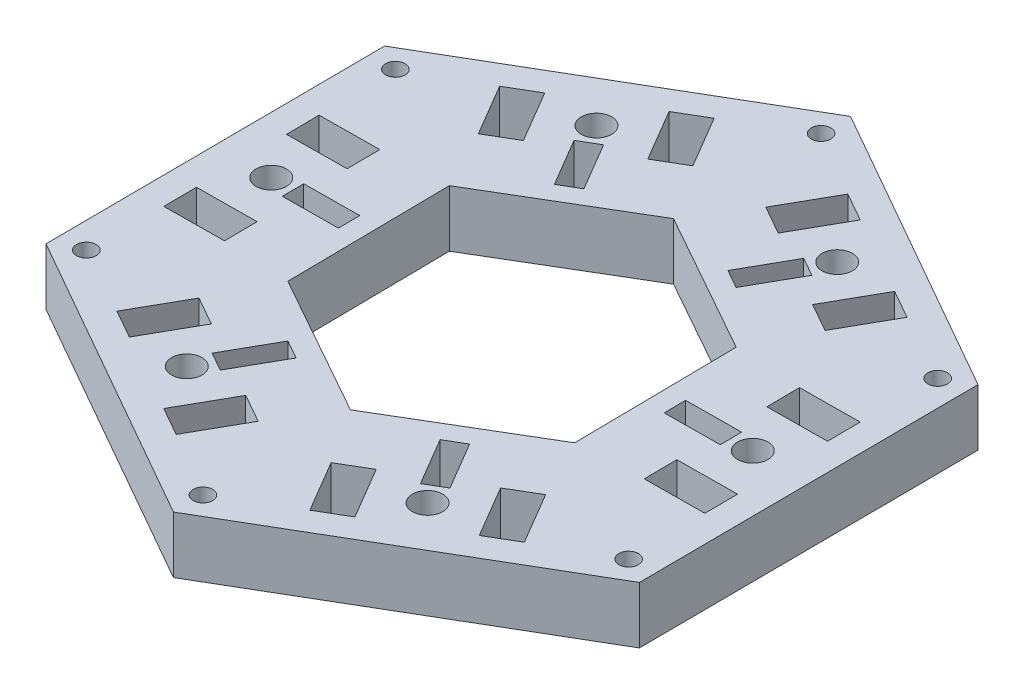
from build123d import *

# Parameters (mm, degrees)
SKETCH1_R           = 1.7
SKETCH1_R_2         = 1.0922
BOSS_EXTRUDE1_DEPTH = 6.35


with BuildPart() as part:
    # Sketch1 → Boss-Extrude1 (new body)
    with BuildSketch(Plane(origin=(0, 0, 0), x_dir=(1, 0, 0), z_dir=(0, 1, 0))):
        Polygon((33.108066621, -18.853803983), (32.881906518, 19.245524772), (-0.226160103, 38.099328755), (-33.108066621, 18.853803983), (-32.881906518, -19.245524772), (0.226160103, -38.099328755), align=None)
        Polygon((18.048586735, 1.367257752), (24.27134005, 1.422666977), (24.29282526, -0.990237369), (18.070071945, -1.045646595), align=None, mode=Mode.SUBTRACT)
        Polygon((10.208373314, -14.946905739), (13.367735769, -20.308263579), (11.288841912, -21.53332249), (8.129479458, -16.17196465), align=None, mode=Mode.SUBTRACT)
        Polygon((-7.840213421, -16.314163491), (-10.903604282, -21.730930556), (-13.003983348, -20.54308512), (-9.940592487, -15.126318055), align=None, mode=Mode.SUBTRACT)
        Polygon((-18.048586735, -1.367257752), (-24.27134005, -1.422666977), (-24.29282526, 0.990237369), (-18.070071945, 1.045646595), align=None, mode=Mode.SUBTRACT)
        Polygon((-10.208373314, 14.946905739), (-13.367735769, 20.308263579), (-11.288841912, 21.53332249), (-8.129479458, 16.17196465), align=None, mode=Mode.SUBTRACT)
        Polygon((7.840213421, 16.314163491), (10.903604282, 21.730930556), (13.003983348, 20.54308512), (9.940592487, 15.126318055), align=None, mode=Mode.SUBTRACT)
        Polygon((-0.226160103, 18.296993457), (15.732581095, 9.344357123), (15.958741198, -8.952636334), (0.226160103, -18.296993457), (-15.732581095, -9.344357123), (-15.958741198, 8.952636334), align=None, mode=Mode.SUBTRACT)
        Polygon((-19.081340765, -15.938883228), (-15.875499033, -17.751910472), (-19.188962617, -23.610862603), (-22.394804349, -21.797835359), align=None, mode=Mode.SUBTRACT)
        with Locations((-13.14163925, -23.237386904)):
            Circle(SKETCH1_R, mode=Mode.SUBTRACT)
        Polygon((-7.031797703, -22.753364938), (-3.825955971, -24.566392182), (-7.139419555, -30.425344314), (-10.345261287, -28.61231707), align=None, mode=Mode.SUBTRACT)
        with Locations((-30.022290634, -17.594524772)):
            Circle(SKETCH1_R_2, mode=Mode.SUBTRACT)
        Polygon((-23.22089091, -5.286967024), (-23.188097695, -8.969821027), (-29.918830872, -9.029753454), (-29.951624087, -5.346899452), align=None, mode=Mode.SUBTRACT)
        with Locations((-26.694987002, -0.237700014)):
            Circle(SKETCH1_R, mode=Mode.SUBTRACT)
        with Locations((0.226160103, -34.797328755)):
            Circle(SKETCH1_R_2, mode=Mode.SUBTRACT)
        Polygon((4.262807401, -24.494367455), (7.435855918, -22.624540696), (10.853125511, -28.4235604), (7.680076994, -30.293387159), align=None, mode=Mode.SUBTRACT)
        with Locations((13.553347751, -22.99968689)):
            Circle(SKETCH1_R, mode=Mode.SUBTRACT)
        Polygon((16.189093207, -17.466397914), (19.362141724, -15.596571155), (22.779411317, -21.395590859), (19.6063628, -23.265417618), align=None, mode=Mode.SUBTRACT)
        with Locations((30.248450738, -17.202803983)):
            Circle(SKETCH1_R_2, mode=Mode.SUBTRACT)
        Polygon((23.344148166, -8.555484227), (23.311354951, -4.872630224), (30.042088128, -4.812697797), (30.074881343, -8.4955518), align=None, mode=Mode.SUBTRACT)
        Polygon((-23.344148166, 8.555484227), (-23.311354951, 4.872630224), (-30.042088128, 4.812697797), (-30.074881343, 8.4955518), align=None, mode=Mode.SUBTRACT)
        with Locations((-30.248450738, 17.202803983)):
            Circle(SKETCH1_R_2, mode=Mode.SUBTRACT)
        Polygon((-16.189093207, 17.466397914), (-19.362141724, 15.596571155), (-22.779411317, 21.395590859), (-19.6063628, 23.265417618), align=None, mode=Mode.SUBTRACT)
        with Locations((-13.553347751, 22.99968689)):
            Circle(SKETCH1_R, mode=Mode.SUBTRACT)
        Polygon((-7.435855918, 22.624540696), (-10.853125511, 28.4235604), (-7.680076994, 30.293387159), (-4.262807401, 24.494367455), align=None, mode=Mode.SUBTRACT)
        with Locations((-0.226160103, 34.797328755)):
            Circle(SKETCH1_R_2, mode=Mode.SUBTRACT)
        Polygon((29.918830872, 9.029753454), (29.951624087, 5.346899452), (23.22089091, 5.286967024), (23.188097695, 8.969821027), align=None, mode=Mode.SUBTRACT)
        with Locations((30.022290634, 17.594524772)):
            Circle(SKETCH1_R_2, mode=Mode.SUBTRACT)
        Polygon((7.031797703, 22.753364938), (3.825955971, 24.566392182), (7.139419555, 30.425344314), (10.345261287, 28.61231707), align=None, mode=Mode.SUBTRACT)
        with Locations((13.14163925, 23.237386904)):
            Circle(SKETCH1_R, mode=Mode.SUBTRACT)
        Polygon((19.081340765, 15.938883228), (15.875499033, 17.751910472), (19.188962617, 23.610862603), (22.394804349, 21.797835359), align=None, mode=Mode.SUBTRACT)
        with Locations((26.694987002, 0.237700014)):
            Circle(SKETCH1_R, mode=Mode.SUBTRACT)
    extrude(amount=-BOSS_EXTRUDE1_DEPTH)


solid = part.part
